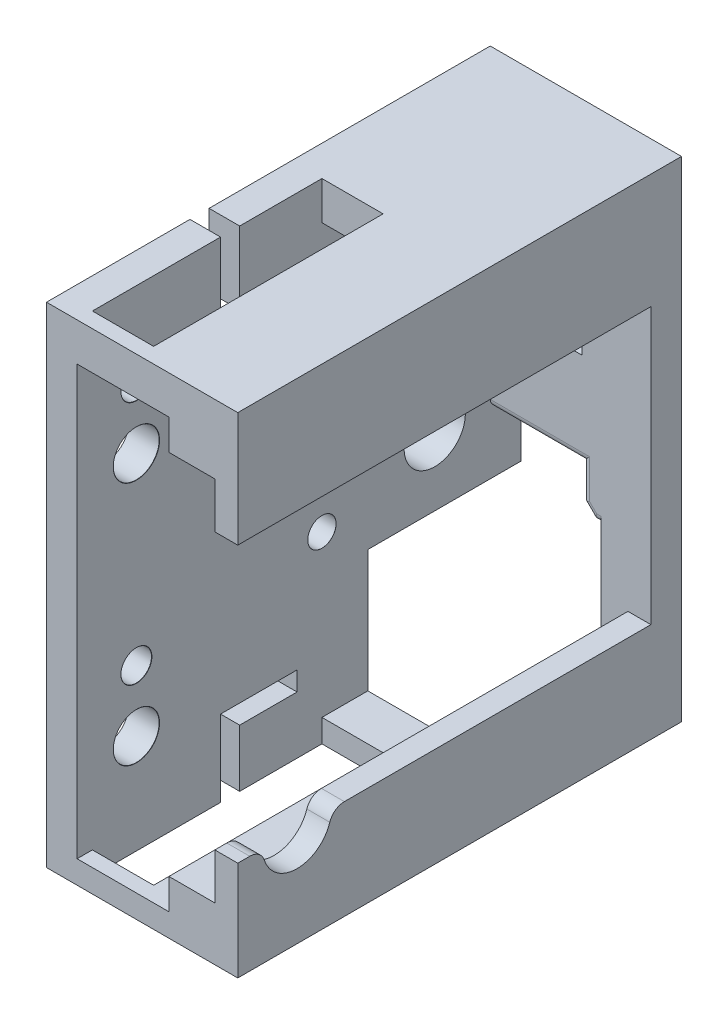
from build123d import *

# Parameters (mm, degrees)
SKETCH1_W                       = 62
SKETCH1_H                       = 58
BOSS_EXTRUDE1_DEPTH             = 4
BOSS_EXTRUDE2_DEPTH             = 58
F_4_0MM_DOWEL_HOLE1_D           = 3.7
F_4_0MM_DOWEL_HOLE1_DEPTH       = 30
F_4_0MM_DOWEL_HOLE1_CSINK_D     = 3.71
F_4_0MM_DOWEL_HOLE1_CSINK_ANGLE = 90
F_4_0MM_DOWEL_HOLE1_TIP         = 1.111592145
F_6_0MM_DOWEL_HOLE1_AT_2_COUNT  = 2
F_6_0MM_DOWEL_HOLE1_AT_2_PITCH  = 32
F_6_0MM_DOWEL_HOLE1_AT_3_COUNT  = 2
F_6_0MM_DOWEL_HOLE1_AT_3_PITCH  = 42.544094772
SKETCH9_W                       = 9
SKETCH9_H                       = 62
BOSS_EXTRUDE3_DEPTH             = 4
SKETCH11_W                      = 9
SKETCH11_H                      = 58
BOSS_EXTRUDE4_DEPTH             = 4
F_4_0MM_DOWEL_HOLE2_AT_2_COUNT  = 2
F_4_0MM_DOWEL_HOLE2_AT_2_PITCH  = 32
SKETCH17_W                      = 8
SKETCH17_H                      = 30
CUT_EXTRUDE1_DEPTH              = 10
SKETCH20_W                      = 16
SKETCH20_H                      = 20
CUT_EXTRUDE2_DEPTH              = 10
CUT_EXTRUDE3_DEPTH              = 10
SKETCH22_R                      = 4
CUT_EXTRUDE4_DEPTH              = 10
SKETCH23_W                      = 12
SKETCH23_H                      = 20
CUT_EXTRUDE5_DEPTH              = 10
SKETCH24_W                      = 2.5
SKETCH24_H                      = 14
CUT_EXTRUDE6_DEPTH              = 10
MOVE_FACE2_BY                   = 2
SKETCH25_W                      = 12
SKETCH25_H                      = 12
BOSS_EXTRUDE5_DEPTH             = 4
EXTRUDE_THIN1_DEPTH             = 2
CHAMFER1_SIZE                   = 1.5
FILLET3_R                       = 1
SKETCH28_R                      = 4.5
CUT_EXTRUDE7_DEPTH              = 10
FILLET4_R                       = 2
EXTRUDE_THIN2_DEPTH             = 2
CUT_EXTRUDE9_DEPTH              = 0.8


with BuildPart() as part:
    # Sketch1 → Boss-Extrude1 (new body)
    with BuildSketch(Plane.YZ):
        Rectangle(SKETCH1_W, SKETCH1_H)
    extrude(amount=-BOSS_EXTRUDE1_DEPTH)

    # Sketch3 → Boss-Extrude2 (add)
    with BuildSketch(Plane.XY.offset(29)):
        Polygon((0, 31), (21, 31), (21, 28), (21, 18), (18, 18), (18, 28), (0, 28), align=None)
        Polygon((0, -31), (21, -31), (21, -28), (21, -18), (18, -18), (18, -28), (0, -28), align=None)
    extrude(amount=-BOSS_EXTRUDE2_DEPTH)

    # Ø4.0mm Dowel Hole1
    with Locations(Plane(origin=(0, 0, 0), x_dir=(0, 0, -1), z_dir=(1, 0, 0))):
        with Locations((3, -7), (3, 7), (16, 7)):
            CounterSinkHole(F_4_0MM_DOWEL_HOLE1_D / 2, F_4_0MM_DOWEL_HOLE1_CSINK_D / 2, depth=F_4_0MM_DOWEL_HOLE1_DEPTH, counter_sink_angle=F_4_0MM_DOWEL_HOLE1_CSINK_ANGLE)
            with Locations((0, 0, -(F_4_0MM_DOWEL_HOLE1_DEPTH + F_4_0MM_DOWEL_HOLE1_TIP / 2))):  # 118° drill point
                Cone(0, F_4_0MM_DOWEL_HOLE1_D / 2, F_4_0MM_DOWEL_HOLE1_TIP, mode=Mode.SUBTRACT)

    # Sketch7 → Ø6.0mm Dowel Hole1 (revolve, cut)
    with BuildSketch(Plane(origin=(0, 14, 21.25), x_dir=(0, 0, -1), z_dir=(0, 1, 0))):
        Polygon((0, 0), (0, 31.802581857), (3, 30), (3, 0.025), (3.025, 0), align=None)
    f_6_0mm_dowel_hole1 = revolve(axis=Axis((6.35, 14, 21.25), (-1, 0, 0)), mode=Mode.SUBTRACT)

    # Ø6.0mm Dowel Hole1 at 2: Ø6.0mm Dowel Hole1 ×2
    with Locations(*[(0, -i * F_6_0MM_DOWEL_HOLE1_AT_2_PITCH, 0) for i in range(1, F_6_0MM_DOWEL_HOLE1_AT_2_COUNT)]):
        add(f_6_0mm_dowel_hole1, mode=Mode.SUBTRACT)

    # Ø6.0mm Dowel Hole1 at 3: Ø6.0mm Dowel Hole1 ×2
    with Locations(*[Vector(0, -0.39958542051392815, -0.9166959647084235) * (i * F_6_0MM_DOWEL_HOLE1_AT_3_PITCH) for i in range(1, F_6_0MM_DOWEL_HOLE1_AT_3_COUNT)]):
        add(f_6_0mm_dowel_hole1, mode=Mode.SUBTRACT)

    # Sketch9 → Boss-Extrude3 (add)
    with BuildSketch(Plane(origin=(0, 0, -29), x_dir=(1, 0, 0), z_dir=(0, 0, -1))):
        with Locations((16.5, 0)):
            Rectangle(SKETCH9_W, SKETCH9_H)
    extrude(amount=-BOSS_EXTRUDE3_DEPTH)

    # Sketch11 → Boss-Extrude4 (add)
    with BuildSketch(Plane(origin=(0, -28, 0), x_dir=(-1, 0, 0), z_dir=(0, 1, 0))):
        with Locations((-16.5, 0)):
            Rectangle(SKETCH11_W, SKETCH11_H)
    boss_extrude4 = extrude(amount=BOSS_EXTRUDE4_DEPTH)

    # Mirror1: Boss-Extrude4 across plane
    add(boss_extrude4.mirror(Plane.ZX))

    # Sketch14 → Ø4.0mm Dowel Hole2 (revolve, cut)
    with BuildSketch(Plane(origin=(0, -10, 21.25), x_dir=(0, 0, -1), z_dir=(0, 1, 0))):
        Polygon((0, 0), (0, 31.201721238), (2, 30), (2, 0.025), (2.025, 0), align=None)
    f_4_0mm_dowel_hole2 = revolve(axis=Axis((6.35, -10, 21.25), (-1, 0, 0)), mode=Mode.SUBTRACT)

    # Ø4.0mm Dowel Hole2 at 2: Ø4.0mm Dowel Hole2 ×2
    with Locations(*[(0, i * F_4_0MM_DOWEL_HOLE2_AT_2_PITCH, 0) for i in range(1, F_4_0MM_DOWEL_HOLE2_AT_2_COUNT)]):
        add(f_4_0mm_dowel_hole2, mode=Mode.SUBTRACT)

    # Sketch17 → Cut-Extrude1 (cut)
    with BuildSketch(Plane.XZ.offset(31)):
        with Locations((4, 12)):
            Rectangle(SKETCH17_W, SKETCH17_H)
    cut_extrude1 = extrude(amount=-CUT_EXTRUDE1_DEPTH, mode=Mode.SUBTRACT)

    # Sketch20 → Cut-Extrude2 (cut)
    with BuildSketch(Plane.YZ):
        with Locations((-20, -19)):
            Rectangle(SKETCH20_W, SKETCH20_H)
    extrude(amount=-CUT_EXTRUDE2_DEPTH, mode=Mode.SUBTRACT)

    # Sketch21 → Cut-Extrude3 (cut)
    with BuildSketch(Plane.YZ):
        Polygon((-31, 10.25), (-21, 10.25), (-21, 7.75), (-21, 0.25), (-23.5, 0.25), (-23.5, 7.75), (-31, 7.75), align=None)
    cut_extrude3 = extrude(amount=-CUT_EXTRUDE3_DEPTH, mode=Mode.SUBTRACT)

    # Mirror2: Cut-Extrude1, Cut-Extrude3 across plane
    add(cut_extrude1.mirror(Plane.ZX), mode=Mode.SUBTRACT)
    add(cut_extrude3.mirror(Plane.ZX), mode=Mode.SUBTRACT)

    # Sketch22 → Cut-Extrude4 (cut)
    with BuildSketch(Plane.YZ):
        with Locations(Location((-3, -17.75, 0), (0, 0, 270))):
            Circle(SKETCH22_R)
    extrude(amount=-CUT_EXTRUDE4_DEPTH, mode=Mode.SUBTRACT)

    # Sketch23 → Cut-Extrude5 (cut)
    with BuildSketch(Plane.XZ.offset(31)):
        with Locations((2, -19)):
            Rectangle(SKETCH23_W, SKETCH23_H)
    extrude(amount=-CUT_EXTRUDE5_DEPTH, mode=Mode.SUBTRACT)

    # Sketch24 → Cut-Extrude6 (cut)
    with BuildSketch(Plane.XY.offset(-25)):
        with Locations((13.25, -17)):
            Rectangle(SKETCH24_W, SKETCH24_H)
    extrude(amount=-CUT_EXTRUDE6_DEPTH, mode=Mode.SUBTRACT)

    # Move Face2: a face moved outward by 2.0
    extrude(part.faces().sort_by_distance((9.4875, 31, -2.475))[0], amount=MOVE_FACE2_BY, dir=(0, 1, 0))

    # Sketch25 → Boss-Extrude5 (add)
    with BuildSketch(Plane.XY.offset(-25)):
        with Locations((6, 2)):
            Rectangle(SKETCH25_W, SKETCH25_H)
    extrude(amount=-BOSS_EXTRUDE5_DEPTH)

    # Sketch26 → Extrude-Thin1 (add)
    with BuildSketch(Plane(origin=(-4, 0, 0), x_dir=(0, -1, 0), z_dir=(-1, 0, 0))):
        Polygon((6.579571669, -23.95), (10.159143338, -17.75), (6.579571669, -11.55), (-0.579571669, -11.55), (-4.159143338, -17.75), (-0.579571669, -23.95), align=None)
        Polygon((6.0022214, -22.95), (9.0044428, -17.75), (6.0022214, -12.55), (-0.0022214, -12.55), (-3.0044428, -17.75), (-0.0022214, -22.95), align=None, mode=Mode.SUBTRACT)
    extrude(amount=EXTRUDE_THIN1_DEPTH)

    # Chamfer1
    chamfer1_edges = [part.edges().sort_by_distance(p)[0] for p in [
        (12, -10, -27),
    ]]
    chamfer(chamfer1_edges, length=CHAMFER1_SIZE)

    # Fillet3
    fillet3_edges = [part.edges().sort_by_distance(p)[0] for p in [
        (14, -10, -25),
        (6, -4, -25),
        (12, -6.25, -25),
        (12.75, -9.25, -25),
    ]]
    fillet(fillet3_edges, radius=FILLET3_R)

    # Sketch28 → Cut-Extrude7 (cut)
    with BuildSketch(Plane.YZ.offset(21)):
        with Locations((-18, 21.25)):
            Circle(SKETCH28_R)
    extrude(amount=-CUT_EXTRUDE7_DEPTH, mode=Mode.SUBTRACT)

    # Fillet4
    fillet4_edges = [part.edges().sort_by_distance(p)[0] for p in [
        (19.5, -18, 25.75),
        (19.5, -18, 16.75),
    ]]
    fillet(fillet4_edges, radius=FILLET4_R)

    # Sketch29 → Extrude-Thin2 (add)
    # profile 1 of 3: a face of its own
    with BuildSketch(Plane(origin=(-4, 0, 0), x_dir=(0, -1, 0), z_dir=(-1, 0, 0))):
        Polygon((-4.517393842, -7.3), (-2.034787685, -3), (-4.517393842, 1.3), (-9.482606158, 1.3), (-11.965212315, -3), (-9.482606158, -7.3), align=None)
        Polygon((-5.383419246, -5.8), (-3.766838493, -3), (-5.383419246, -0.2), (-8.616580754, -0.2), (-10.233161507, -3), (-8.616580754, -5.8), align=None, mode=Mode.SUBTRACT)
    # profile 2 of 3: a face of its own
    with BuildSketch(Plane(origin=(-4, 0, 0), x_dir=(0, -1, 0), z_dir=(-1, 0, 0))):
        Polygon((9.482606158, -7.3), (11.965212315, -3), (9.482606158, 1.3), (4.517393842, 1.3), (2.034787685, -3), (4.517393842, -7.3), align=None)
        Polygon((8.616580754, -5.8), (10.233161507, -3), (8.616580754, -0.2), (5.383419246, -0.2), (3.766838493, -3), (5.383419246, -5.8), align=None, mode=Mode.SUBTRACT)
    # profile 3 of 3: a face of its own
    with BuildSketch(Plane(origin=(-4, 0, 0), x_dir=(0, -1, 0), z_dir=(-1, 0, 0))):
        Polygon((-4.517393842, -20.3), (-2.034787685, -16), (-4.517393842, -11.7), (-9.482606158, -11.7), (-11.965212315, -16), (-9.482606158, -20.3), align=None)
        Polygon((-5.383419246, -18.8), (-3.766838493, -16), (-5.383419246, -13.2), (-8.616580754, -13.2), (-10.233161507, -16), (-8.616580754, -18.8), align=None, mode=Mode.SUBTRACT)
    extrude(amount=EXTRUDE_THIN2_DEPTH)

    # Sketch30 → Cut-Extrude9 (cut)
    with BuildSketch(Plane(origin=(-4, 0, 0), x_dir=(0, -1, 0), z_dir=(-1, 0, 0))):
        Polygon((-8.616580754, -0.2), (-10.233161507, -3), (-8.616580754, -5.8), (-5.383419246, -5.8), (-3.766838493, -3), (-5.383419246, -0.2), align=None)
        Polygon((5.383419246, -0.2), (3.766838493, -3), (5.383419246, -5.8), (8.616580754, -5.8), (10.233161507, -3), (8.616580754, -0.2), align=None)
        Polygon((-10.233161507, -16), (-8.616580754, -18.8), (-5.383419246, -18.8), (-3.766838493, -16), (-5.383419246, -13.2), (-8.616580754, -13.2), align=None)
    extrude(amount=-CUT_EXTRUDE9_DEPTH, mode=Mode.SUBTRACT)


solid = part.part
